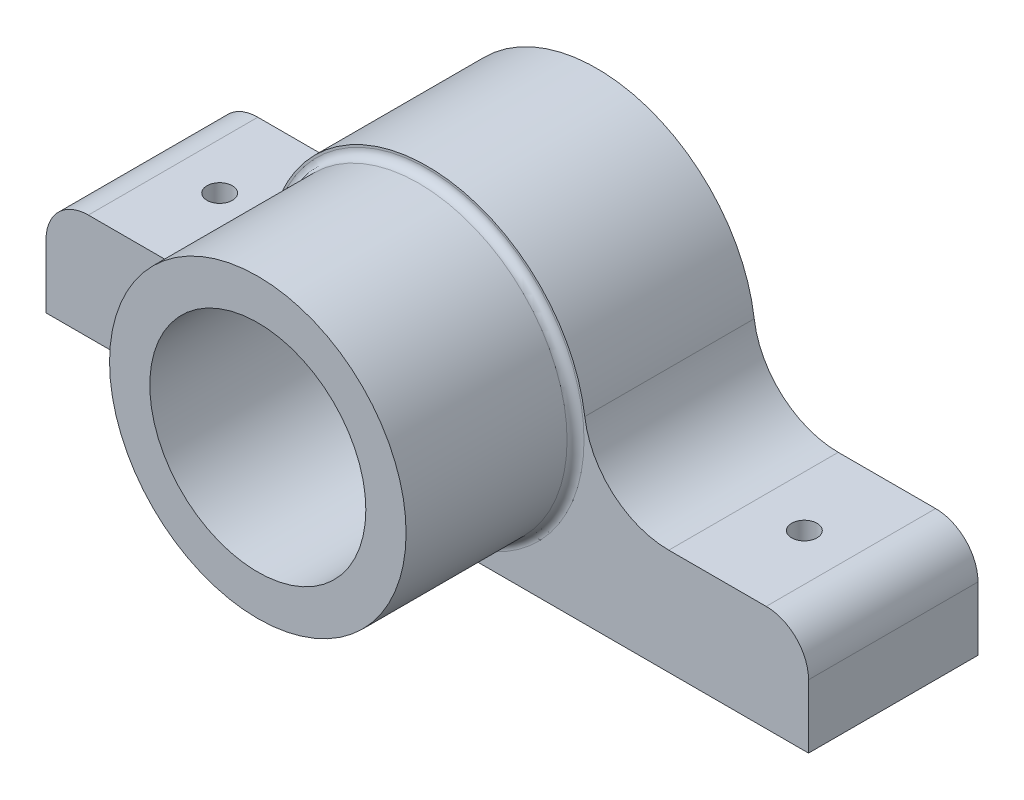
from build123d import *

# Parameters (mm, degrees)
SKETCH1_R               = 0.635
BOSS_EXTRUDE1_DEPTH     = 5.08
SKETCH2_R               = 4.445
SKETCH2_R_2             = 0.635
BOSS_EXTRUDE2_DEPTH     = 5.08
SKETCH3_R               = 3.2385
CUT_EXTRUDE1_DEPTH      = 6.35
FILLET1_R               = 0.254
FILLET2_R               = 2.54
FILLET3_R               = 1.27
SKETCH5_R               = 0.381
CUT_EXTRUDE3_DEPTH      = 83.603101422
CUT_EXTRUDE4_DEPTH      = 83.603101422
CUT_EXTRUDE4_DEPTH_BACK = 83.603101422
SKETCH7_W               = 65.357576663
SKETCH7_H               = 10.612338137
FILLET4_R               = 1.27


with BuildPart() as part:
    # Sketch1 → Boss-Extrude1 (new body)
    with BuildSketch(Plane.XY):
        with BuildLine():
            Line((0, 0), (76.64958, 0))
            Line((76.64958, 0), (81.72958, 0))
            Line((81.72958, 0), (81.72958, 3.175))
            Line((81.72958, 3.175), (76.64958, 3.175))
            Line((76.64958, 3.175), (75.06208, 3.175))
            Line((75.06208, 3.175), (75.06208, 4.7625))
            ThreePointArc((75.06208, 4.7625), (70.29958, 9.525), (65.53708, 4.7625))
            Line((65.53708, 4.7625), (65.53708, 3.175))
            Line((65.53708, 3.175), (11.1125, 3.175))
            Line((11.1125, 3.175), (11.1125, 4.7625))
            ThreePointArc((11.1125, 4.7625), (6.35, 9.525), (1.5875, 4.7625))
            Line((1.5875, 4.7625), (1.5875, 3.175))
            Line((1.5875, 3.175), (0, 3.175))
            Line((0, 3.175), (-5.08, 3.175))
            Line((-5.08, 3.175), (-5.08, 0))
            Line((-5.08, 0), (0, 0))
        make_face()
        with Locations((6.35, 4.7625)):
            Circle(SKETCH1_R, mode=Mode.SUBTRACT)
        with Locations((70.29958, 4.7625)):
            Circle(SKETCH1_R, mode=Mode.SUBTRACT)
    extrude(amount=BOSS_EXTRUDE1_DEPTH)

    # Sketch2 → Boss-Extrude2 (add)
    # profile 1 of 2: a face of its own
    with BuildSketch(Plane.XY.offset(5.08)):
        with Locations((6.35, 4.7625)):
            Circle(SKETCH2_R)
        with Locations((6.35, 4.7625)):
            Circle(SKETCH2_R_2, mode=Mode.SUBTRACT)
    # profile 2 of 2: a face of its own
    with BuildSketch(Plane.XY.offset(5.08)):
        with Locations((70.29958, 4.7625)):
            Circle(SKETCH2_R)
        with Locations((70.29958, 4.7625)):
            Circle(SKETCH2_R_2, mode=Mode.SUBTRACT)
    extrude(amount=BOSS_EXTRUDE2_DEPTH)

    # Sketch3 → Cut-Extrude1 (cut)
    with BuildSketch(Plane.XY.offset(10.16)):
        with Locations((6.35, 4.7625)):
            Circle(SKETCH3_R)
        with Locations((70.29958, 4.7625)):
            Circle(SKETCH3_R)
    extrude(amount=-CUT_EXTRUDE1_DEPTH, mode=Mode.SUBTRACT)

    # Fillet1
    fillet1_edges = [part.edges().sort_by_distance(p)[0] for p in [
        (1.905, 4.7625, 5.08),
        (65.85458, 4.7625, 5.08),
    ]]
    fillet(fillet1_edges, radius=FILLET1_R)

    # Fillet2
    fillet2_edges = [part.edges().sort_by_distance(p)[0] for p in [
        (75.06208, 3.175, 2.54),
        (11.1125, 3.175, 2.54),
        (65.53708, 3.175, 2.54),
        (1.5875, 3.175, 2.54),
    ]]
    fillet(fillet2_edges, radius=FILLET2_R)

    # Fillet3
    fillet3_edges = [part.edges().sort_by_distance(p)[0] for p in [
        (-5.08, 3.175, 2.54),
        (81.72958, 3.175, 2.54),
    ]]
    fillet(fillet3_edges, radius=FILLET3_R)

    # Sketch5 → Cut-Extrude3 (cut, through all)
    with BuildSketch(Plane(origin=(0, 3.175, 0), x_dir=(1, 0, 0), z_dir=(0, 1, 0))):
        with Locations(Location((-2.413, -2.54, 0), (0, 0, 180))):
            Circle(SKETCH5_R)
        with Locations(Location((79.06258, -2.54, 0), (0, 0, 180))):
            Circle(SKETCH5_R)
        with Locations(Location((61.53658, -2.54, 0), (0, 0, 180))):
            Circle(SKETCH5_R)
        with Locations(Location((15.113, -2.54, 0), (0, 0, 180))):
            Circle(SKETCH5_R)
    extrude(amount=-CUT_EXTRUDE3_DEPTH, mode=Mode.SUBTRACT)

    # Sketch7 → Cut-Extrude4 (cut, two sides: drawn at the far end of the back side and taken through both)
    with BuildSketch(Plane(origin=(0, 3.175, 0), x_dir=(1, 0, 0), z_dir=(0, 1, 0)).offset(-CUT_EXTRUDE4_DEPTH_BACK)):
        with Locations((50.458788332, -5.306169069)):
            Rectangle(SKETCH7_W, SKETCH7_H)
    extrude(amount=CUT_EXTRUDE4_DEPTH + CUT_EXTRUDE4_DEPTH_BACK, mode=Mode.SUBTRACT)

    # Fillet4
    fillet4_edges = [part.edges().sort_by_distance(p)[0] for p in [
        (17.78, 3.175, 2.54),
    ]]
    fillet(fillet4_edges, radius=FILLET4_R)


solid = part.part
